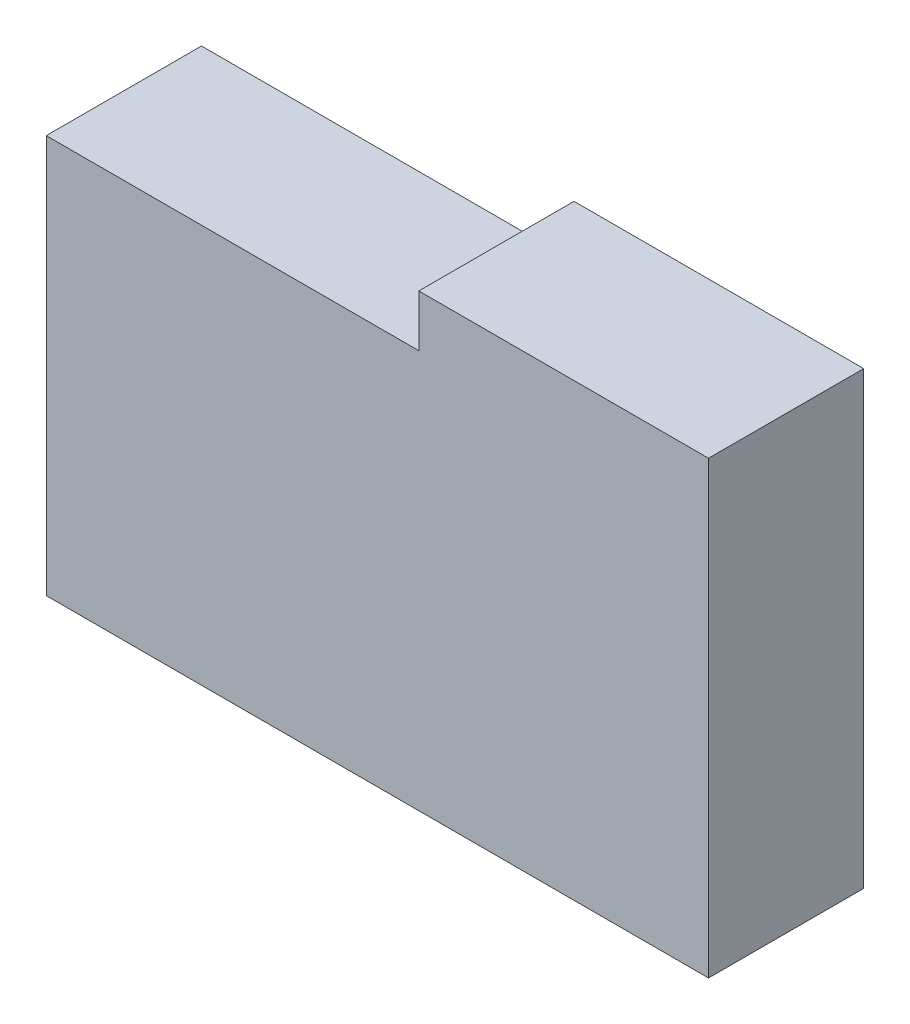
from build123d import *

# Parameters (mm, degrees)
BOSS_EXTRU_1_DEPTH = 30


with BuildPart() as part:
    # Esquisse1 → Boss.-Extru.1 (new body)
    with BuildSketch(Plane.XY):
        Polygon((0, 0), (128, 0), (128, 87), (72, 87), (72, 77), (0, 77), align=None)
    extrude(amount=-BOSS_EXTRU_1_DEPTH)


solid = part.part
